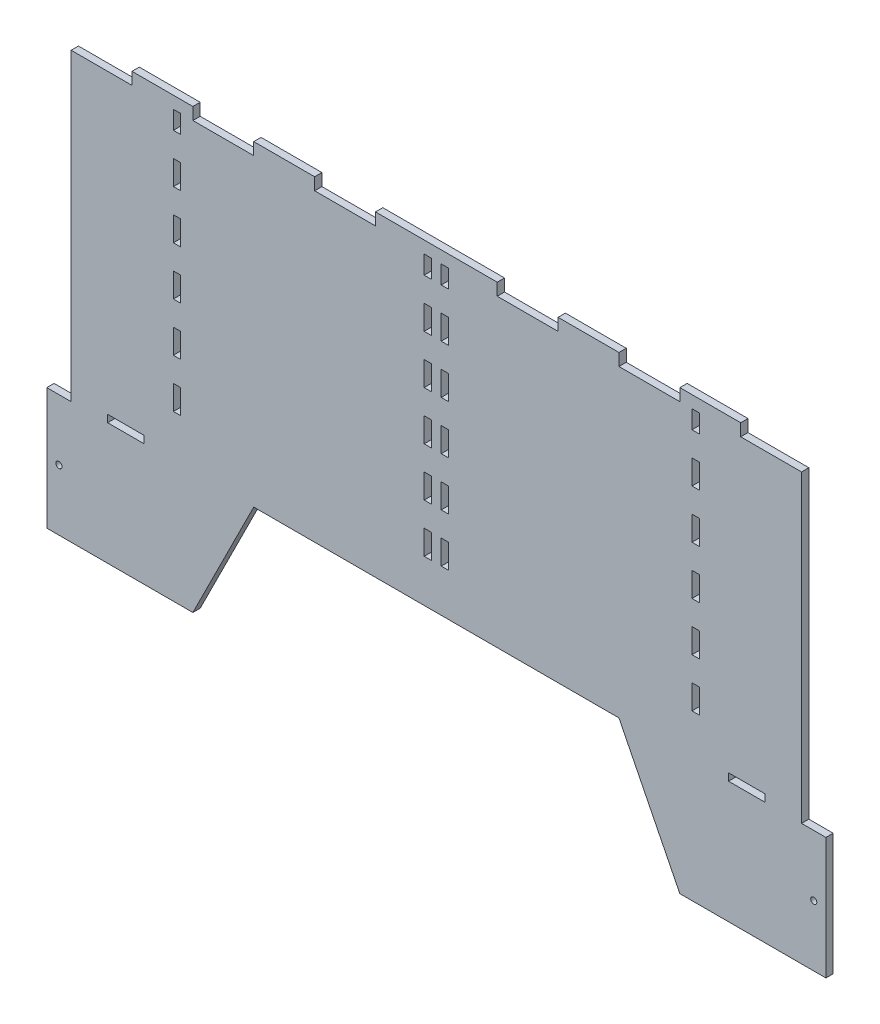
from build123d import *

# Parameters (mm, degrees)
SKETCH_1_W      = 6
SKETCH_1_H      = 15
SKETCH_1_R      = 2.5
SKETCH_1_W_2    = 30
SKETCH_1_H_2    = 6
SKETCH_1_H_3    = 20
EXTRUDE_1_DEPTH = 6


with BuildPart() as part:
    # 草图1 → 凸台-拉伸1 (new body)
    with BuildSketch(Plane.XY):
        Polygon((50, 0), (0, 0), (0, -250), (-20, -250), (-20, -350), (100, -350), (150, -250), (450, -250), (500, -350), (620, -350), (620, -250), (600, -250), (600, 0), (550, 0), (550, 10), (500, 10), (500, 0), (450, 0), (450, 10), (400, 10), (400, 0), (350, 0), (350, 10), (300, 10), (250, 10), (250, 0), (200, 0), (200, 10), (150, 10), (150, 0), (100, 0), (100, 10), (50, 10), align=None)
        with Locations((513, -7.5)):
            Rectangle(SKETCH_1_W, SKETCH_1_H, mode=Mode.SUBTRACT)
        with Locations((-10, -300)):
            Circle(SKETCH_1_R, mode=Mode.SUBTRACT)
        with Locations((45, -247)):
            Rectangle(SKETCH_1_W_2, SKETCH_1_H_2, mode=Mode.SUBTRACT)
        with Locations((87, -205)):
            Rectangle(SKETCH_1_W, SKETCH_1_H_3, mode=Mode.SUBTRACT)
        with Locations((87, -165)):
            Rectangle(SKETCH_1_W, SKETCH_1_H_3, mode=Mode.SUBTRACT)
        with Locations((293, -205)):
            Rectangle(SKETCH_1_W, SKETCH_1_H_3, mode=Mode.SUBTRACT)
        with Locations((293, -165)):
            Rectangle(SKETCH_1_W, SKETCH_1_H_3, mode=Mode.SUBTRACT)
        with Locations((610, -300)):
            Circle(SKETCH_1_R, mode=Mode.SUBTRACT)
        with Locations((555, -247)):
            Rectangle(SKETCH_1_W_2, SKETCH_1_H_2, mode=Mode.SUBTRACT)
        with Locations((307, -205)):
            Rectangle(SKETCH_1_W, SKETCH_1_H_3, mode=Mode.SUBTRACT)
        with Locations((307, -165)):
            Rectangle(SKETCH_1_W, SKETCH_1_H_3, mode=Mode.SUBTRACT)
        with Locations((513, -205)):
            Rectangle(SKETCH_1_W, SKETCH_1_H_3, mode=Mode.SUBTRACT)
        with Locations((513, -165)):
            Rectangle(SKETCH_1_W, SKETCH_1_H_3, mode=Mode.SUBTRACT)
        with Locations((87, -125)):
            Rectangle(SKETCH_1_W, SKETCH_1_H_3, mode=Mode.SUBTRACT)
        with Locations((87, -85)):
            Rectangle(SKETCH_1_W, SKETCH_1_H_3, mode=Mode.SUBTRACT)
        with Locations((293, -125)):
            Rectangle(SKETCH_1_W, SKETCH_1_H_3, mode=Mode.SUBTRACT)
        with Locations((293, -85)):
            Rectangle(SKETCH_1_W, SKETCH_1_H_3, mode=Mode.SUBTRACT)
        with Locations((87, -45)):
            Rectangle(SKETCH_1_W, SKETCH_1_H_3, mode=Mode.SUBTRACT)
        with Locations((87, -7.5)):
            Rectangle(SKETCH_1_W, SKETCH_1_H, mode=Mode.SUBTRACT)
        with Locations((293, -45)):
            Rectangle(SKETCH_1_W, SKETCH_1_H_3, mode=Mode.SUBTRACT)
        with Locations((293, -7.5)):
            Rectangle(SKETCH_1_W, SKETCH_1_H, mode=Mode.SUBTRACT)
        with Locations((307, -125)):
            Rectangle(SKETCH_1_W, SKETCH_1_H_3, mode=Mode.SUBTRACT)
        with Locations((307, -85)):
            Rectangle(SKETCH_1_W, SKETCH_1_H_3, mode=Mode.SUBTRACT)
        with Locations((513, -125)):
            Rectangle(SKETCH_1_W, SKETCH_1_H_3, mode=Mode.SUBTRACT)
        with Locations((513, -85)):
            Rectangle(SKETCH_1_W, SKETCH_1_H_3, mode=Mode.SUBTRACT)
        with Locations((307, -45)):
            Rectangle(SKETCH_1_W, SKETCH_1_H_3, mode=Mode.SUBTRACT)
        with Locations((307, -7.5)):
            Rectangle(SKETCH_1_W, SKETCH_1_H, mode=Mode.SUBTRACT)
        with Locations((513, -45)):
            Rectangle(SKETCH_1_W, SKETCH_1_H_3, mode=Mode.SUBTRACT)
    extrude(amount=EXTRUDE_1_DEPTH)


solid = part.part
